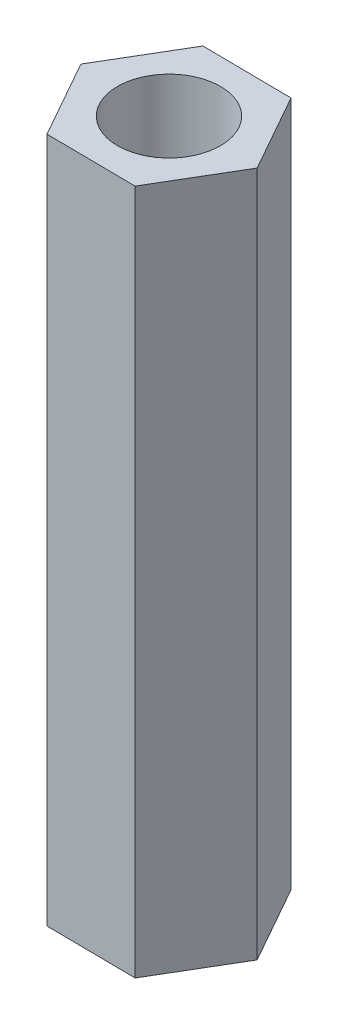
from build123d import *

# Parameters (mm, degrees)
BOSS_EXTRUDE2_DEPTH = 20
SKETCH4_R           = 1.5
CUT_EXTRUDE2_DEPTH  = 20


with BuildPart() as part:
    # Sketch3 → Boss-Extrude2 (new body)
    with BuildSketch(Plane(origin=(0, 0, 0), x_dir=(1, 0, 0), z_dir=(0, 1, 0))):
        Polygon((1.275131566, -2.263634134), (2.597930447, -0.027520738), (1.322798882, 2.236113396), (-1.275131566, 2.263634134), (-2.597930447, 0.027520738), (-1.322798882, -2.236113396), align=None)
    extrude(amount=BOSS_EXTRUDE2_DEPTH)

    # Sketch4 → Cut-Extrude2 (cut)
    with BuildSketch(Plane(origin=(0, 20, 0), x_dir=(1, 0, 0), z_dir=(0, 1, 0))):
        with Locations(Location((0, 0, 0), (0, 0, 270))):
            Circle(SKETCH4_R)
    extrude(amount=-CUT_EXTRUDE2_DEPTH, mode=Mode.SUBTRACT)


solid = part.part
